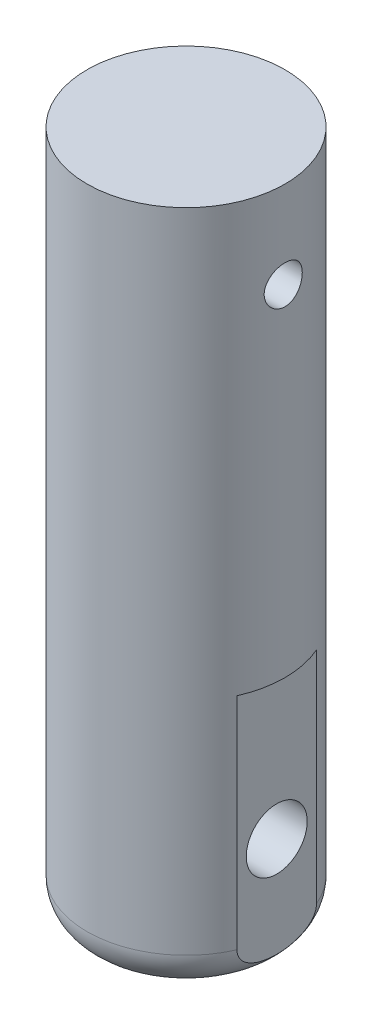
from build123d import *

# Parameters (mm, degrees)
SKETCH_1_R          = 13
EXTRUDE_1_DEPTH     = 90
FILLET_1_R          = 5
SKETCH_3_R          = 4
CUT_EXTRUDE_2_DEPTH = 20
SKETCH_4_W          = 5.638292822
SKETCH_4_H          = 34.801876381
CUT_EXTRUDE_3_DEPTH = 22.5
SKETCH_5_R          = 2.5
CUT_EXTRUDE_1_DEPTH = 55


with BuildPart() as part:
    # Эскиз1 → Вытянуть1 (new body)
    with BuildSketch(Plane(origin=(0, 0, 0), x_dir=(1, 0, 0), z_dir=(0, 1, 0))):
        with Locations(Location((0.959256222, 0, 0), (0, 0, 90))):
            Circle(SKETCH_1_R)
    extrude(amount=EXTRUDE_1_DEPTH)

    # Скругление1
    fillet_1_edges = [part.edges().sort_by_distance(p)[0] for p in [
        (0.959256222, 0, 13),
    ]]
    fillet(fillet_1_edges, radius=FILLET_1_R)

    # Эскиз3 → Вытянуть2 (cut, symmetric)
    with BuildSketch(Plane(origin=(0, 0, 0), x_dir=(0, 0, -1), z_dir=(1, 0, 0))):
        with Locations((0, 15)):
            Circle(SKETCH_3_R)
    extrude(amount=CUT_EXTRUDE_2_DEPTH, both=True, mode=Mode.SUBTRACT)

    # Эскиз4 → Вытянуть3 (cut, symmetric)
    with BuildSketch(Plane.XY):
        with Locations((-13.576502311, 16.48112444)):
            Rectangle(SKETCH_4_W, SKETCH_4_H)
        with Locations((15.684293194, 16.48112444)):
            Rectangle(SKETCH_4_W, SKETCH_4_H)
    extrude(amount=CUT_EXTRUDE_3_DEPTH, both=True, mode=Mode.SUBTRACT)

    # Эскиз5 → Вырез-Вытянуть1 (cut, symmetric)
    with BuildSketch(Plane(origin=(0, 0, 0), x_dir=(0, 0, -1), z_dir=(1, 0, 0))):
        with Locations((9.34e-07, 78.55964506)):
            Circle(SKETCH_5_R)
    extrude(amount=CUT_EXTRUDE_1_DEPTH, both=True, mode=Mode.SUBTRACT)


solid = part.part
